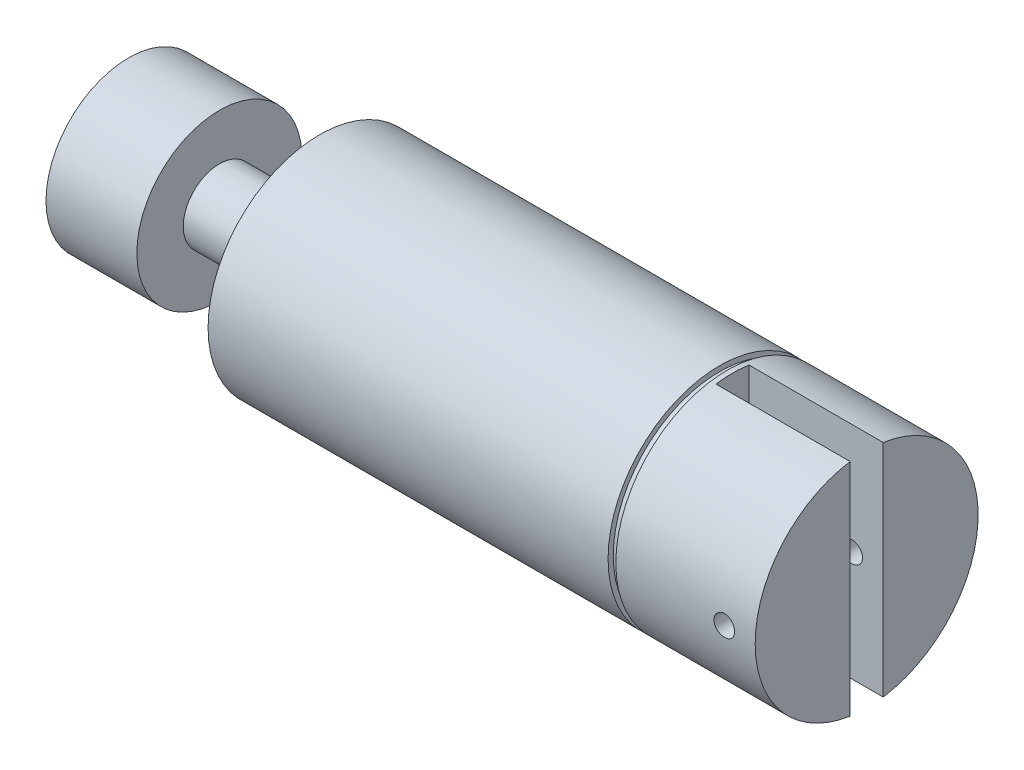
from build123d import *

# Parameters (mm, degrees)
CUT_EXTRUDE1_DEPTH      = 60.252362822
CUT_EXTRUDE1_DEPTH_BACK = 60.252362822
SKETCH2_R               = 1
CUT_EXTRUDE2_DEPTH      = 60.252362859
CUT_EXTRUDE2_DEPTH_BACK = 60.252362859
SKETCH3_W               = 26
SKETCH3_H               = 3.2


with BuildPart() as part:
    # Sketch1 → Revolve1 (revolve)
    with BuildSketch(Plane.XY, mode=Mode.PRIVATE) as revolve1_sk:
        Polygon((-57.25, 0), (-57.25, 8), (-57.042201581, 8), (-48.45, 8), (-48.45, 5.8595471), (-48.45, 3.504470165), (-38.75, 3.504470165), (-38.75, 10.8), (-33.89, 10.8), (0, 10.8), (0, 10.3), (0.75, 10.3), (0.75, 10.8), (14.25, 10.8), (14.25, 0), align=None)
    revolve(revolve1_sk.sketch.rotate(Axis((-38.390119341, 0, 0), (1, 0, 0)), 90), axis=Axis((-38.390119341, 0, 0), (1, 0, 0)))

    # Sketch2 → Cut-Extrude1 (cut, two sides: drawn at the far end of the back side and taken through both)
    with BuildSketch(Plane.XY.offset(-CUT_EXTRUDE1_DEPTH_BACK)):
        with Locations((11.25, 0)):
            Circle(SKETCH2_R)
    extrude(amount=CUT_EXTRUDE1_DEPTH + CUT_EXTRUDE1_DEPTH_BACK, mode=Mode.SUBTRACT)

    # Sketch3 → Cut-Extrude2 (cut, two sides: drawn at the far end of the back side and taken through both)
    with BuildSketch(Plane(origin=(0, 0, 0), x_dir=(1, 0, 0), z_dir=(0, 1, 0)).offset(-CUT_EXTRUDE2_DEPTH_BACK)):
        with Locations((14.25, 0)):
            Rectangle(SKETCH3_W, SKETCH3_H)
    extrude(amount=CUT_EXTRUDE2_DEPTH + CUT_EXTRUDE2_DEPTH_BACK, mode=Mode.SUBTRACT)


solid = part.part
